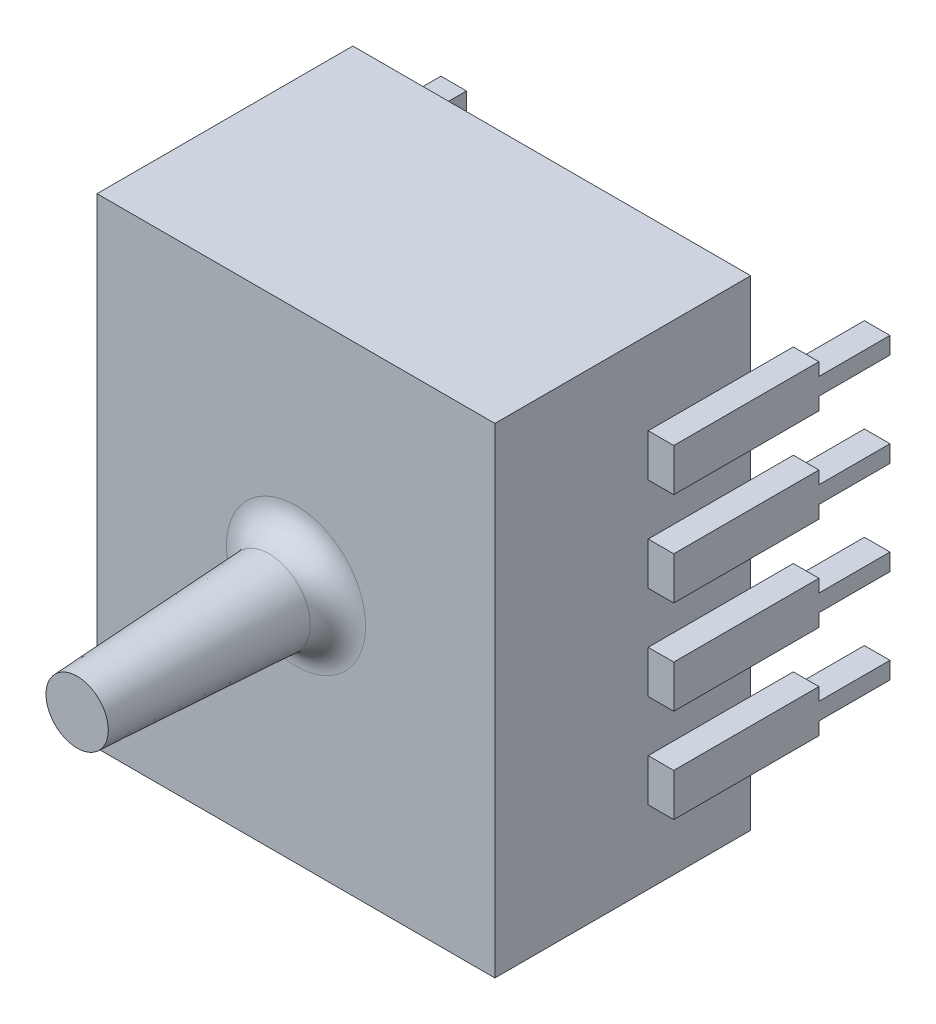
from build123d import *

# Parameters (mm, degrees)
ESQUISSE1_W          = 14
ESQUISSE1_H          = 16.9
BASE_EXTRUSION_DEPTH = 9
EXTRUSION1_DEPTH     = 0.9
EXTRUSION2_DEPTH     = 0.9
ESQUISSE6_R          = 1.5
EXTRUSION3_DEPTH     = 7.7
EXTRUSION3_TAPER     = 3
CONG_1_R             = 1


with BuildPart() as part:
    # Esquisse1 → Base-Extrusion (new body)
    with BuildSketch(Plane.XY):
        with Locations((7, 8.45)):
            Rectangle(ESQUISSE1_W, ESQUISSE1_H)
    extrude(amount=BASE_EXTRUSION_DEPTH)

    # Esquisse4 → Extrusion1 (add)
    with BuildSketch(Plane.ZY):
        Polygon((3.607457233, 13.98057371), (-1.5, 13.98057371), (-1.5, 13.53057371), (-4, 13.53057371), (-4, 12.93057371), (-1.5, 12.93057371), (-1.5, 12.48057371), (3.607457233, 12.48057371), align=None)
        Polygon((3.607457233, 10.68057371), (-1.5, 10.68057371), (-1.5, 10.23057371), (-4, 10.23057371), (-4, 9.63057371), (-1.5, 9.63057371), (-1.5, 9.18057371), (3.607457233, 9.18057371), align=None)
        Polygon((3.607457233, 7.38057371), (-1.5, 7.38057371), (-1.5, 6.93057371), (-4, 6.93057371), (-4, 6.33057371), (-1.5, 6.33057371), (-1.5, 5.88057371), (3.607457233, 5.88057371), align=None)
        Polygon((3.607457233, 4.08057371), (-1.5, 4.08057371), (-1.5, 3.63057371), (-4, 3.63057371), (-4, 3.03057371), (-1.5, 3.03057371), (-1.5, 2.58057371), (3.607457233, 2.58057371), align=None)
    extrude(amount=EXTRUSION1_DEPTH)

    # Esquisse5 → Extrusion2 (add)
    with BuildSketch(Plane(origin=(14, 0, 0), x_dir=(0, 0, -1), z_dir=(1, 0, 0))):
        Polygon((1.5, 13.98057371), (-3.607457233, 13.98057371), (-3.607457233, 12.48057371), (1.5, 12.48057371), (1.5, 12.93057371), (4, 12.93057371), (4, 13.53057371), (1.5, 13.53057371), align=None)
        Polygon((1.5, 7.38057371), (-3.607457233, 7.38057371), (-3.607457233, 5.88057371), (1.5, 5.88057371), (1.5, 6.33057371), (4, 6.33057371), (4, 6.93057371), (1.5, 6.93057371), align=None)
        Polygon((-3.607457233, 10.68057371), (-3.607457233, 9.18057371), (1.5, 9.18057371), (1.5, 9.63057371), (4, 9.63057371), (4, 10.23057371), (1.5, 10.23057371), (1.5, 10.68057371), align=None)
        Polygon((-3.607457233, 4.08057371), (-3.607457233, 2.58057371), (1.5, 2.58057371), (1.5, 3.03057371), (4, 3.03057371), (4, 3.63057371), (1.5, 3.63057371), (1.5, 4.08057371), align=None)
    extrude(amount=EXTRUSION2_DEPTH)

    # Esquisse6 → Extrusion3 (add)
    with BuildSketch(Plane.XY.offset(9)):
        with Locations((7, 8.45)):
            Circle(ESQUISSE6_R)
    extrude(amount=EXTRUSION3_DEPTH, taper=EXTRUSION3_TAPER)

    # Congé1
    cong_1_edges = [part.edges().sort_by_distance(p)[0] for p in [
        (5.5, 8.45, 9),
    ]]
    fillet(cong_1_edges, radius=CONG_1_R)


solid = part.part
